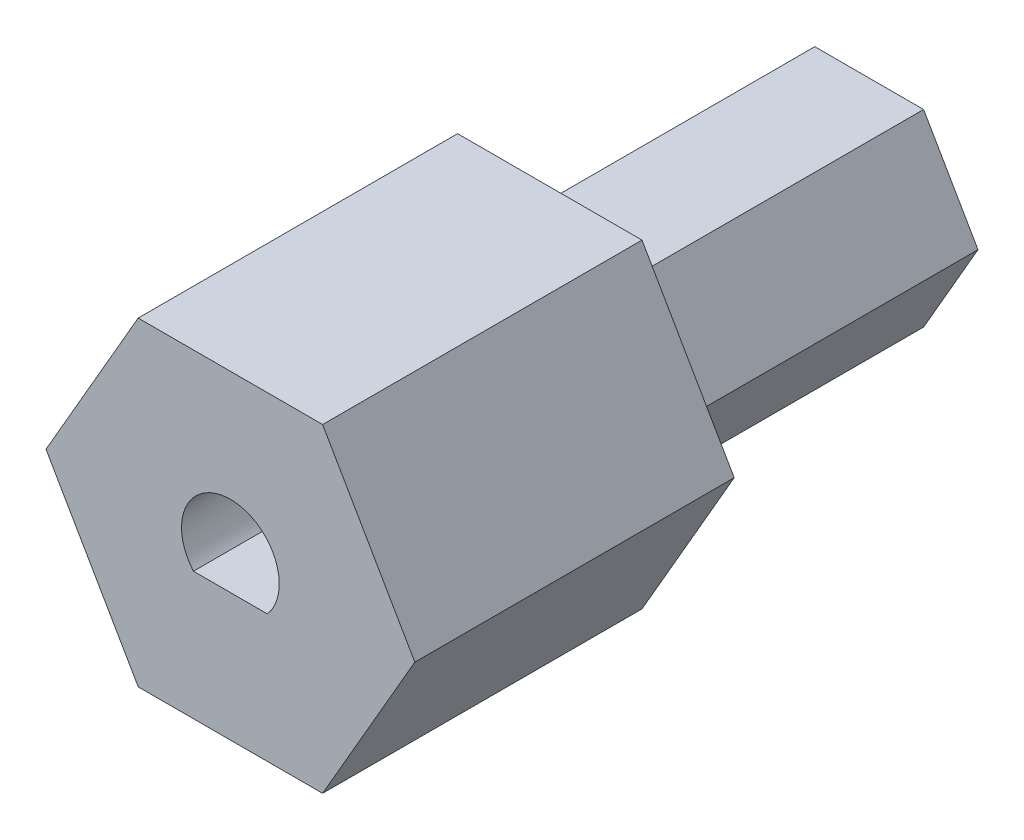
from build123d import *

# Parameters (mm, degrees)
BOSS_EXTRUDE1_DEPTH = 20
BOSS_EXTRUDE2_DEPTH = 10
CUT_EXTRUDE1_DEPTH  = 11


with BuildPart() as part:
    # Sketch1 → Boss-Extrude1 (new body)
    with BuildSketch(Plane.XY):
        Polygon((3.406366588, 0), (1.703183294, 2.95), (-1.703183294, 2.95), (-3.406366588, 0), (-1.703183294, -2.95), (1.703183294, -2.95), align=None)
    extrude(amount=BOSS_EXTRUDE1_DEPTH)

    # Sketch2 → Boss-Extrude2 (add)
    with BuildSketch(Plane.XY.offset(20)):
        Polygon((-5.773502692, 0), (-2.886751346, -5), (2.886751346, -5), (5.773502692, 0), (2.886751346, 5), (-2.886751346, 5), align=None)
    extrude(amount=-BOSS_EXTRUDE2_DEPTH)

    # Sketch4 → Cut-Extrude1 (cut)
    with BuildSketch(Plane.XY.offset(20)):
        with BuildLine():
            Line((-1.157972366, -1), (1.157972366, -1))
            ThreePointArc((1.157972366, -1), (0, 1.53), (-1.157972366, -1))
        make_face()
    extrude(amount=-CUT_EXTRUDE1_DEPTH, mode=Mode.SUBTRACT)


solid = part.part
